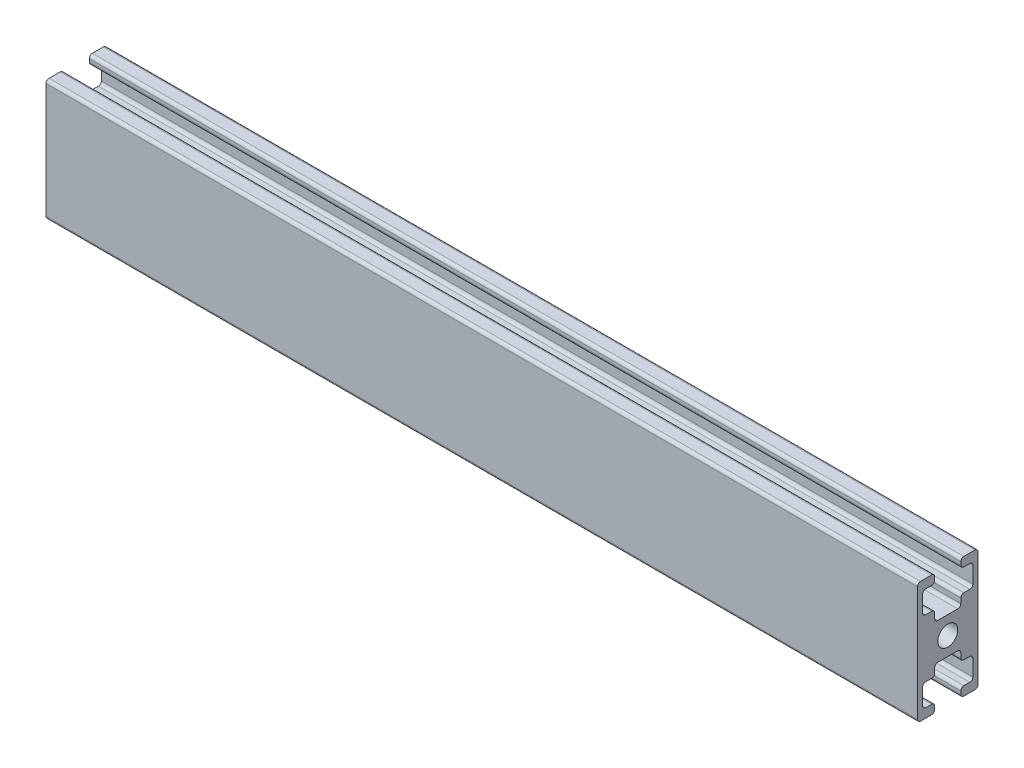
from build123d import *

# Parameters (mm, degrees)
SKETCH_1_R      = 1.65
EXTRUDE_1_DEPTH = 144


with BuildPart() as part:
    # ｽｹｯﾁ1 → ﾎﾞｽ - 押し出し1 (new body)
    with BuildSketch(Plane(origin=(0, 0, 0), x_dir=(0, 0, -1), z_dir=(1, 0, 0))):
        with BuildLine():
            Line((0.5, 0), (2.35, 0))
            ThreePointArc((2.35, 0), (2.703553391, 0.146446609), (2.85, 0.5))
            Line((2.85, 0.5), (2.85, 1))
            ThreePointArc((2.85, 1), (2.703553391, 1.353553391), (2.35, 1.5))
            Line((2.35, 1.5), (1.35, 1.5))
            ThreePointArc((1.35, 1.5), (0.996446609, 1.646446609), (0.85, 2))
            Line((0.85, 2), (0.85, 4.7))
            ThreePointArc((0.85, 4.7), (0.996446609, 5.053553391), (1.35, 5.2))
            Line((1.35, 5.2), (2.35, 5.2))
            ThreePointArc((2.35, 5.2), (2.703553391, 5.346446609), (2.85, 5.7))
            Line((2.85, 5.7), (2.85, 6.5))
            ThreePointArc((2.85, 6.5), (2.996446609, 6.853553391), (3.35, 7))
            Line((3.35, 7), (6.65, 7))
            ThreePointArc((6.65, 7), (7.003553391, 6.853553391), (7.15, 6.5))
            Line((7.15, 6.5), (7.15, 5.7))
            ThreePointArc((7.15, 5.7), (7.296446609, 5.346446609), (7.65, 5.2))
            Line((7.65, 5.2), (8.65, 5.2))
            ThreePointArc((8.65, 5.2), (9.003553391, 5.053553391), (9.15, 4.7))
            Line((9.15, 4.7), (9.15, 2))
            ThreePointArc((9.15, 2), (9.003553391, 1.646446609), (8.65, 1.5))
            Line((8.65, 1.5), (7.65, 1.5))
            ThreePointArc((7.65, 1.5), (7.296446609, 1.353553391), (7.15, 1))
            Line((7.15, 1), (7.15, 0.5))
            ThreePointArc((7.15, 0.5), (7.296446609, 0.146446609), (7.65, 0))
            Line((7.65, 0), (9.5, 0))
            ThreePointArc((9.5, 0), (9.853553391, 0.146446609), (10, 0.5))
            Line((10, 0.5), (10, 19.5))
            ThreePointArc((10, 19.5), (9.853553391, 19.853553391), (9.5, 20))
            Line((9.5, 20), (7.65, 20))
            ThreePointArc((7.65, 20), (7.296446609, 19.853553391), (7.15, 19.5))
            Line((7.15, 19.5), (7.15, 19))
            ThreePointArc((7.15, 19), (7.296446609, 18.646446609), (7.65, 18.5))
            Line((7.65, 18.5), (8.65, 18.5))
            ThreePointArc((8.65, 18.5), (9.003553391, 18.353553391), (9.15, 18))
            Line((9.15, 18), (9.15, 15.3))
            ThreePointArc((9.15, 15.3), (9.003553391, 14.946446609), (8.65, 14.8))
            Line((8.65, 14.8), (7.65, 14.8))
            ThreePointArc((7.65, 14.8), (7.296446609, 14.653553391), (7.15, 14.3))
            Line((7.15, 14.3), (7.15, 13.5))
            ThreePointArc((7.15, 13.5), (7.003553391, 13.146446609), (6.65, 13))
            Line((6.65, 13), (3.35, 13))
            ThreePointArc((3.35, 13), (2.996446609, 13.146446609), (2.85, 13.5))
            Line((2.85, 13.5), (2.85, 14.3))
            ThreePointArc((2.85, 14.3), (2.703553391, 14.653553391), (2.35, 14.8))
            Line((2.35, 14.8), (1.35, 14.8))
            ThreePointArc((1.35, 14.8), (0.996446609, 14.946446609), (0.85, 15.3))
            Line((0.85, 15.3), (0.85, 18))
            ThreePointArc((0.85, 18), (0.996446609, 18.353553391), (1.35, 18.5))
            Line((1.35, 18.5), (2.35, 18.5))
            ThreePointArc((2.35, 18.5), (2.703553391, 18.646446609), (2.85, 19))
            Line((2.85, 19), (2.85, 19.5))
            ThreePointArc((2.85, 19.5), (2.703553391, 19.853553391), (2.35, 20))
            Line((2.35, 20), (0.5, 20))
            ThreePointArc((0.5, 20), (0.146446609, 19.853553391), (0, 19.5))
            Line((0, 19.5), (0, 0.5))
            ThreePointArc((0, 0.5), (0.146446609, 0.146446609), (0.5, 0))
        make_face()
        with Locations((5, 10)):
            Circle(SKETCH_1_R, mode=Mode.SUBTRACT)
    extrude(amount=EXTRUDE_1_DEPTH)


solid = part.part
